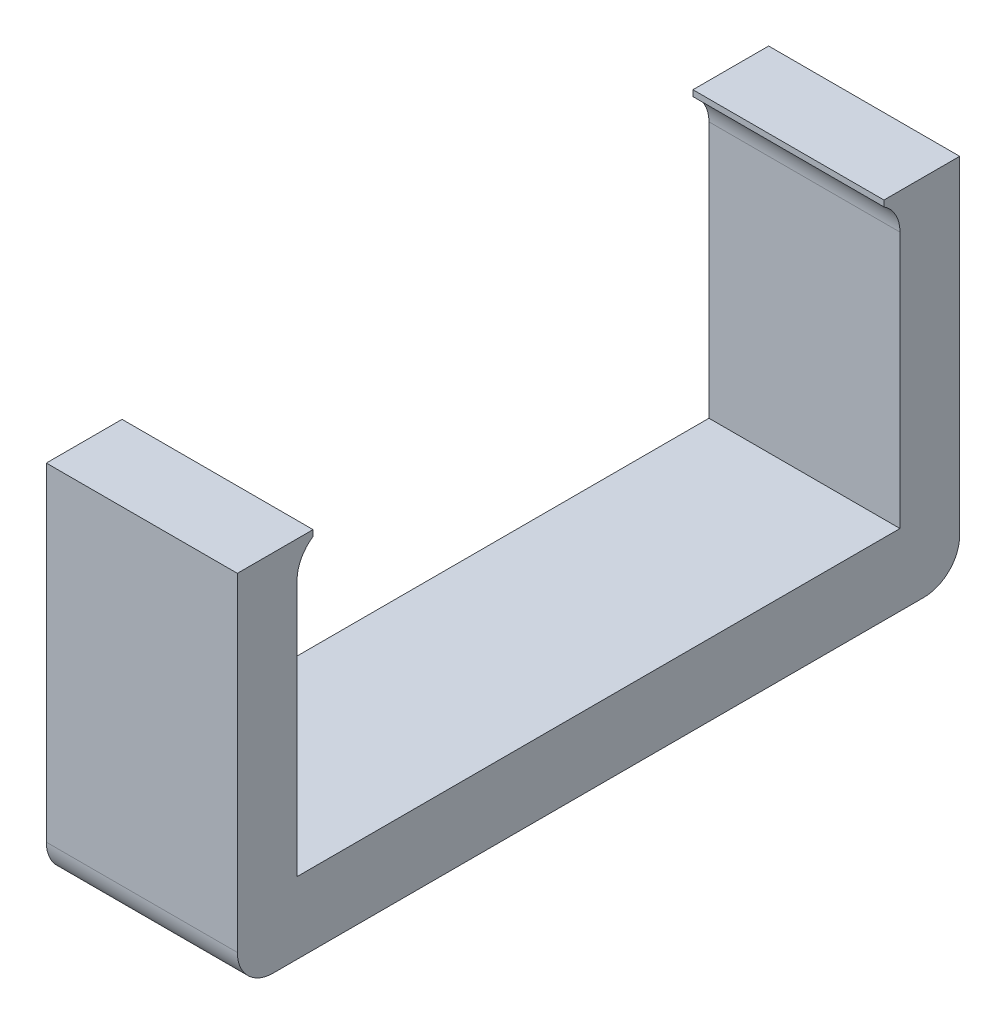
from build123d import *

# Parameters (mm, degrees)
PROFILEBOSS_EXTRUDE1_DEPTH = 8


with BuildPart() as part:
    # Sketch2 → ProfileBoss-Extrude1 (new body)
    with BuildSketch(Plane(origin=(0, 0, 0), x_dir=(0, 0, -1), z_dir=(1, 0, 0))):
        with BuildLine():
            Line((1.5, 0), (28.75, 0))
            ThreePointArc((28.75, 0), (29.810660172, 0.439339828), (30.25, 1.5))
            Line((30.25, 1.5), (30.25, 15.25))
            Line((30.25, 15.25), (27.079156198, 15.25))
            Line((27.079156198, 15.25), (27.079156198, 15))
            ThreePointArc((27.079156198, 15), (27.571691018, 14.459318583), (27.75, 13.75))
            Line((27.75, 13.75), (27.75, 3))
            Line((27.75, 3), (2.5, 3))
            Line((2.5, 3), (2.5, 13.75))
            ThreePointArc((2.5, 13.75), (2.678308982, 14.459318583), (3.170843802, 15))
            Line((3.170843802, 15), (3.170843802, 15.25))
            Line((3.170843802, 15.25), (0, 15.25))
            Line((0, 15.25), (0, 1.5))
            ThreePointArc((0, 1.5), (0.439339828, 0.439339828), (1.5, 0))
        make_face()
    extrude(amount=PROFILEBOSS_EXTRUDE1_DEPTH)


solid = part.part
